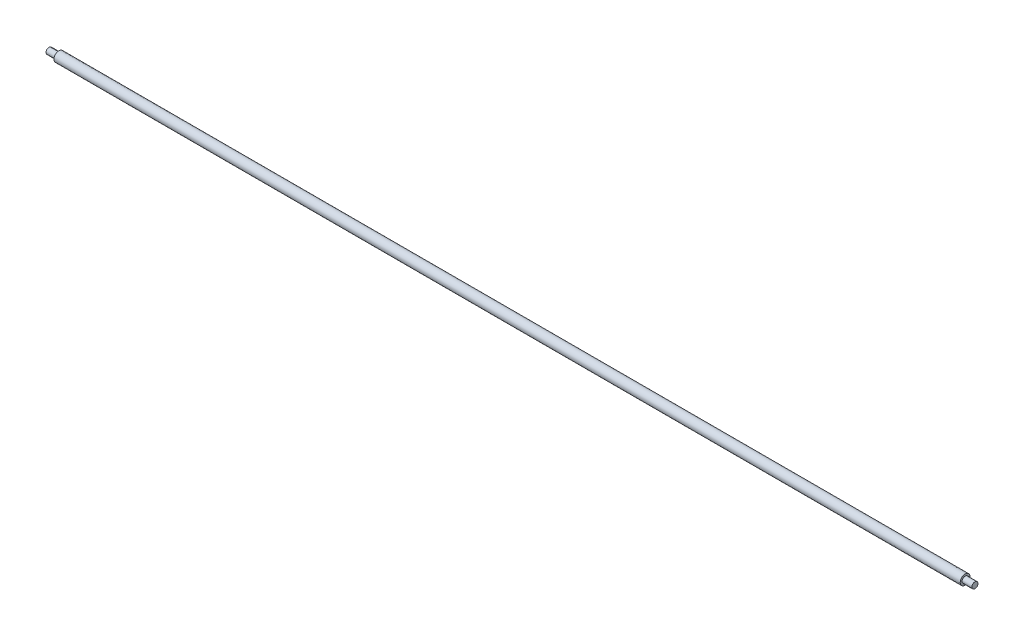
from build123d import *

# Parameters (mm, degrees)
SKETCH3_R                = 1.651
SKETCH3_R_2              = 1.02616
BOSS_EXTRUDE1_DEPTH      = 152.4
BOSS_EXTRUDE2_DEPTH      = 155.702
BOSS_EXTRUDE2_DEPTH_BACK = 155.702
SKETCH4_R                = 1.02616
SKETCH5_R                = 1.03124
SKETCH5_R_2              = 1.02616
CUT_EXTRUDE1_DEPTH       = 309.110846946


with BuildPart() as part:
    # Sketch3 → Boss-Extrude1 (new, symmetric)
    with BuildSketch(Plane(origin=(0, 0, 0), x_dir=(0, 0, -1), z_dir=(1, 0, 0))):
        Circle(SKETCH3_R)
        Circle(SKETCH3_R_2, mode=Mode.SUBTRACT)
    extrude(amount=BOSS_EXTRUDE1_DEPTH, both=True)

    # Sketch5 → Cut-Extrude1 (cut, through all)
    with BuildSketch(Plane(origin=(152.4, 0, 0), x_dir=(0, 0, -1), z_dir=(1, 0, 0))):
        Circle(SKETCH5_R)
        Circle(SKETCH5_R_2, mode=Mode.SUBTRACT)
    extrude(amount=-CUT_EXTRUDE1_DEPTH, mode=Mode.SUBTRACT)


with BuildPart() as body_2:
    # Sketch4 → Boss-Extrude2 (new, two sides: drawn at the far end of the back side and taken through both)
    with BuildSketch(Plane(origin=(0, 0, 0), x_dir=(0, 0, -1), z_dir=(1, 0, 0)).offset(-BOSS_EXTRUDE2_DEPTH_BACK)):
        Circle(SKETCH4_R)
    extrude(amount=BOSS_EXTRUDE2_DEPTH + BOSS_EXTRUDE2_DEPTH_BACK)


solid = Compound([part.part, body_2.part])
